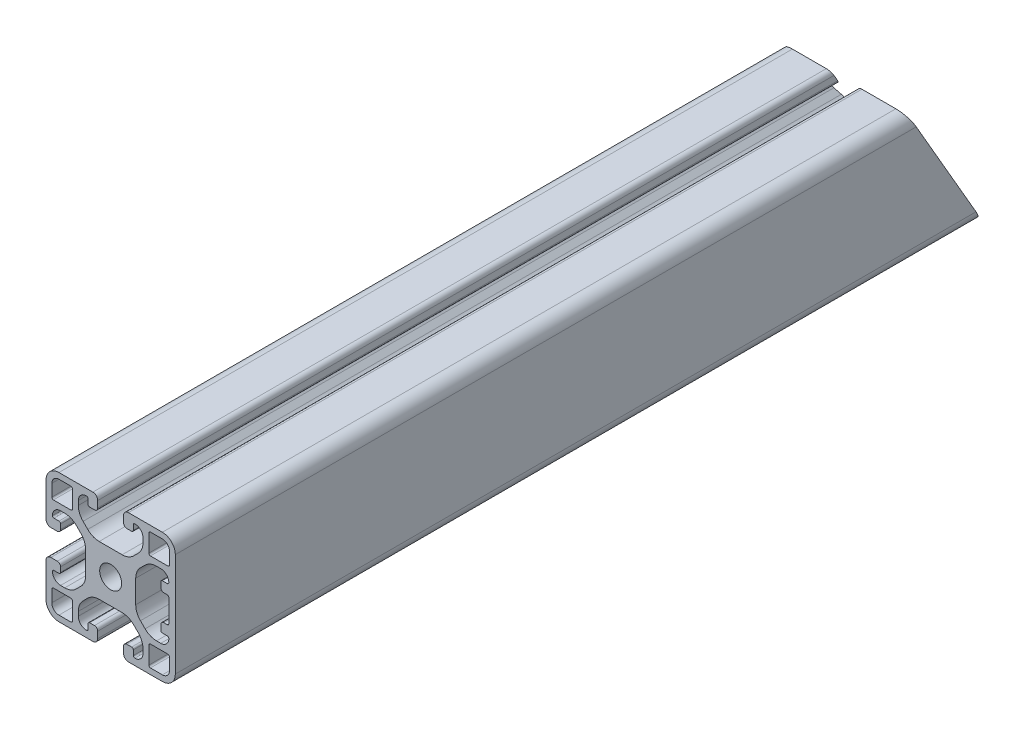
from build123d import *

# Parameters (mm, degrees)
SCHIZZO1_R                   = 3.4
ESTRUSIONE_ESTRUSIONE1_DEPTH = 250
TAGLIO_ESTRUSIONE1_DEPTH     = 343.92856399


with BuildPart() as part:
    # Schizzo1 → Estrusione-Estrusione1 (new body)
    with BuildSketch(Plane(origin=(0, 0, -340), x_dir=(-1, 0, 0), z_dir=(0, 0, -1))):
        with BuildLine():
            Line((6.5, -15.5), (5, -15.5))
            ThreePointArc((5, -15.5), (4.292893219, -15.792893219), (4, -16.5))
            Line((4, -16.5), (4, -18.5))
            ThreePointArc((4, -18.5), (4.439339828, -19.560660172), (5.5, -20))
            Line((5.5, -20), (16, -20))
            ThreePointArc((16, -20), (18.828427125, -18.828427125), (20, -16))
            Line((20, -16), (20, -5.5))
            ThreePointArc((20, -5.5), (19.560660172, -4.439339828), (18.5, -4))
            Line((18.5, -4), (16.5, -4))
            ThreePointArc((16.5, -4), (15.792893219, -4.292893219), (15.5, -5))
            Line((15.5, -5), (15.5, -6.5))
            ThreePointArc((15.5, -6.5), (15.646446609, -6.853553391), (16, -7))
            Line((16, -7), (17.55, -7))
            ThreePointArc((17.55, -7), (17.868198052, -7.131801948), (18, -7.45))
            Line((18, -7.45), (18, -7.5))
            ThreePointArc((18, -7.5), (17.267766953, -9.267766953), (15.5, -10))
            Line((15.5, -10), (14.192388155, -10))
            ThreePointArc((14.192388155, -10), (12.278970994, -9.619397663), (10.656854249, -8.535533906))
            Line((10.656854249, -8.535533906), (9.214466094, -7.09314575))
            ThreePointArc((9.214466094, -7.09314575), (8.130602337, -5.471029006), (7.75, -3.557611845))
            Line((7.75, -3.557611845), (7.75, 3.557611845))
            ThreePointArc((7.75, 3.557611845), (8.130602337, 5.471029006), (9.214466094, 7.09314575))
            Line((9.214466094, 7.09314575), (10.656854249, 8.535533906))
            ThreePointArc((10.656854249, 8.535533906), (12.278970994, 9.619397663), (14.192388155, 10))
            Line((14.192388155, 10), (15.5, 10))
            ThreePointArc((15.5, 10), (17.267766953, 9.267766953), (18, 7.5))
            Line((18, 7.5), (18, 7.45))
            ThreePointArc((18, 7.45), (17.868198052, 7.131801948), (17.55, 7))
            Line((17.55, 7), (16, 7))
            ThreePointArc((16, 7), (15.646446609, 6.853553391), (15.5, 6.5))
            Line((15.5, 6.5), (15.5, 5))
            ThreePointArc((15.5, 5), (15.792893219, 4.292893219), (16.5, 4))
            Line((16.5, 4), (18.5, 4))
            ThreePointArc((18.5, 4), (19.560660172, 4.439339828), (20, 5.5))
            Line((20, 5.5), (20, 16))
            ThreePointArc((20, 16), (18.828427125, 18.828427125), (16, 20))
            Line((16, 20), (5.5, 20))
            ThreePointArc((5.5, 20), (4.439339828, 19.560660172), (4, 18.5))
            Line((4, 18.5), (4, 16.5))
            ThreePointArc((4, 16.5), (4.292893219, 15.792893219), (5, 15.5))
            Line((5, 15.5), (6.5, 15.5))
            ThreePointArc((6.5, 15.5), (6.853553391, 15.646446609), (7, 16))
            Line((7, 16), (7, 17.55))
            ThreePointArc((7, 17.55), (7.131801948, 17.868198052), (7.45, 18))
            Line((7.45, 18), (7.5, 18))
            ThreePointArc((7.5, 18), (9.267766953, 17.267766953), (10, 15.5))
            Line((10, 15.5), (10, 14.192388155))
            ThreePointArc((10, 14.192388155), (9.619397663, 12.278970994), (8.535533906, 10.656854249))
            Line((8.535533906, 10.656854249), (7.09314575, 9.214466094))
            ThreePointArc((7.09314575, 9.214466094), (5.471029006, 8.130602337), (3.557611844, 7.75))
            Line((3.557611844, 7.75), (-3.557611845, 7.75))
            ThreePointArc((-3.557611845, 7.75), (-5.471029006, 8.130602337), (-7.09314575, 9.214466094))
            Line((-7.09314575, 9.214466094), (-8.535533906, 10.656854249))
            ThreePointArc((-8.535533906, 10.656854249), (-9.619397663, 12.278970994), (-10, 14.192388155))
            Line((-10, 14.192388155), (-10, 15.5))
            ThreePointArc((-10, 15.5), (-9.267766953, 17.267766953), (-7.5, 18))
            Line((-7.5, 18), (-7.45, 18))
            ThreePointArc((-7.45, 18), (-7.131801948, 17.868198052), (-7, 17.55))
            Line((-7, 17.55), (-7, 16))
            ThreePointArc((-7, 16), (-6.853553391, 15.646446609), (-6.5, 15.5))
            Line((-6.5, 15.5), (-5, 15.5))
            ThreePointArc((-5, 15.5), (-4.292893219, 15.792893219), (-4, 16.5))
            Line((-4, 16.5), (-4, 18.5))
            ThreePointArc((-4, 18.5), (-4.439339828, 19.560660172), (-5.5, 20))
            Line((-5.5, 20), (-16, 20))
            ThreePointArc((-16, 20), (-18.828427125, 18.828427125), (-20, 16))
            Line((-20, 16), (-20, -16))
            ThreePointArc((-20, -16), (-18.828427125, -18.828427125), (-16, -20))
            Line((-16, -20), (-5.5, -20))
            ThreePointArc((-5.5, -20), (-4.439339828, -19.560660172), (-4, -18.5))
            Line((-4, -18.5), (-4, -16.5))
            ThreePointArc((-4, -16.5), (-4.292893219, -15.792893219), (-5, -15.5))
            Line((-5, -15.5), (-6.5, -15.5))
            ThreePointArc((-6.5, -15.5), (-6.853553391, -15.646446609), (-7, -16))
            Line((-7, -16), (-7, -17.55))
            ThreePointArc((-7, -17.55), (-7.131801948, -17.868198052), (-7.45, -18))
            Line((-7.45, -18), (-7.5, -18))
            ThreePointArc((-7.5, -18), (-9.267766953, -17.267766953), (-10, -15.5))
            Line((-10, -15.5), (-10, -14.192388155))
            ThreePointArc((-10, -14.192388155), (-9.619397663, -12.278970994), (-8.535533906, -10.656854249))
            Line((-8.535533906, -10.656854249), (-7.09314575, -9.214466094))
            ThreePointArc((-7.09314575, -9.214466094), (-5.471029006, -8.130602337), (-3.557611845, -7.75))
            Line((-3.557611845, -7.75), (3.557611845, -7.75))
            ThreePointArc((3.557611845, -7.75), (5.471029006, -8.130602337), (7.09314575, -9.214466094))
            Line((7.09314575, -9.214466094), (8.535533906, -10.656854249))
            ThreePointArc((8.535533906, -10.656854249), (9.619397663, -12.278970994), (10, -14.192388155))
            Line((10, -14.192388155), (10, -15.5))
            ThreePointArc((10, -15.5), (9.267766953, -17.267766953), (7.5, -18))
            Line((7.5, -18), (7.45, -18))
            ThreePointArc((7.45, -18), (7.131801948, -17.868198052), (7, -17.55))
            Line((7, -17.55), (7, -16))
            ThreePointArc((7, -16), (6.853553391, -15.646446609), (6.5, -15.5))
        make_face()
        with Locations(Location((0, 0, 0), (0, 0, 180))):
            Circle(SCHIZZO1_R, mode=Mode.SUBTRACT)
        with BuildLine():
            Line((-12.3, -18.2), (-16, -18.2))
            ThreePointArc((-16, -18.2), (-17.555634919, -17.555634919), (-18.2, -16))
            Line((-18.2, -16), (-18.2, -12.3))
            ThreePointArc((-18.2, -12.3), (-18.053553391, -11.946446609), (-17.7, -11.8))
            Line((-17.7, -11.8), (-12.3, -11.8))
            ThreePointArc((-12.3, -11.8), (-11.946446609, -11.946446609), (-11.8, -12.3))
            Line((-11.8, -12.3), (-11.8, -17.7))
            ThreePointArc((-11.8, -17.7), (-11.946446609, -18.053553391), (-12.3, -18.2))
        make_face(mode=Mode.SUBTRACT)
        with BuildLine():
            Line((-11.8, 17.7), (-11.8, 12.3))
            ThreePointArc((-11.8, 12.3), (-11.946446609, 11.946446609), (-12.3, 11.8))
            Line((-12.3, 11.8), (-17.7, 11.8))
            ThreePointArc((-17.7, 11.8), (-18.053553391, 11.946446609), (-18.2, 12.3))
            Line((-18.2, 12.3), (-18.2, 16))
            ThreePointArc((-18.2, 16), (-17.555634919, 17.555634919), (-16, 18.2))
            Line((-16, 18.2), (-12.3, 18.2))
            ThreePointArc((-12.3, 18.2), (-11.946446609, 18.053553391), (-11.8, 17.7))
        make_face(mode=Mode.SUBTRACT)
        with BuildLine():
            Line((18.2, 16), (18.2, 12.3))
            ThreePointArc((18.2, 12.3), (18.053553391, 11.946446609), (17.7, 11.8))
            Line((17.7, 11.8), (12.3, 11.8))
            ThreePointArc((12.3, 11.8), (11.946446609, 11.946446609), (11.8, 12.3))
            Line((11.8, 12.3), (11.8, 17.7))
            ThreePointArc((11.8, 17.7), (11.946446609, 18.053553391), (12.3, 18.2))
            Line((12.3, 18.2), (16, 18.2))
            ThreePointArc((16, 18.2), (17.555634919, 17.555634919), (18.2, 16))
        make_face(mode=Mode.SUBTRACT)
        with BuildLine():
            Line((18.2, -12.3), (18.2, -16))
            ThreePointArc((18.2, -16), (17.555634919, -17.555634919), (16, -18.2))
            Line((16, -18.2), (12.3, -18.2))
            ThreePointArc((12.3, -18.2), (11.946446609, -18.053553391), (11.8, -17.7))
            Line((11.8, -17.7), (11.8, -12.3))
            ThreePointArc((11.8, -12.3), (11.946446609, -11.946446609), (12.3, -11.8))
            Line((12.3, -11.8), (17.7, -11.8))
            ThreePointArc((17.7, -11.8), (18.053553391, -11.946446609), (18.2, -12.3))
        make_face(mode=Mode.SUBTRACT)
        with BuildLine():
            Line((-16, 7), (-17.5, 7))
            ThreePointArc((-17.5, 7), (-17.853553391, 7.146446609), (-18, 7.5))
            ThreePointArc((-18, 7.5), (-17.267766953, 9.267766953), (-15.5, 10))
            Line((-15.5, 10), (-14.192388155, 10))
            ThreePointArc((-14.192388155, 10), (-12.278970994, 9.619397663), (-10.656854249, 8.535533906))
            Line((-10.656854249, 8.535533906), (-9.214466094, 7.093145751))
            ThreePointArc((-9.214466094, 7.093145751), (-8.130602337, 5.471029006), (-7.75, 3.557611845))
            Line((-7.75, 3.557611845), (-7.75, -3.557611845))
            ThreePointArc((-7.75, -3.557611845), (-8.130602337, -5.471029006), (-9.214466094, -7.093145751))
            Line((-9.214466094, -7.093145751), (-10.656854249, -8.535533906))
            ThreePointArc((-10.656854249, -8.535533906), (-12.278970994, -9.619397663), (-14.192388155, -10))
            Line((-14.192388155, -10), (-15.5, -10))
            ThreePointArc((-15.5, -10), (-17.267766953, -9.267766953), (-18, -7.5))
            ThreePointArc((-18, -7.5), (-17.853553391, -7.146446609), (-17.5, -7))
            Line((-17.5, -7), (-16, -7))
            ThreePointArc((-16, -7), (-15.646446609, -6.853553391), (-15.5, -6.5))
            Line((-15.5, -6.5), (-15.5, -5))
            ThreePointArc((-15.5, -5), (-15.792893219, -4.292893219), (-16.5, -4))
            Line((-16.5, -4), (-17.5, -4))
            ThreePointArc((-17.5, -4), (-17.853553391, -3.853553391), (-18, -3.5))
            Line((-18, -3.5), (-18, 3.5))
            ThreePointArc((-18, 3.5), (-17.853553391, 3.853553391), (-17.5, 4))
            Line((-17.5, 4), (-16.5, 4))
            ThreePointArc((-16.5, 4), (-15.792893219, 4.292893219), (-15.5, 5))
            Line((-15.5, 5), (-15.5, 6.5))
            ThreePointArc((-15.5, 6.5), (-15.646446609, 6.853553391), (-16, 7))
        make_face(mode=Mode.SUBTRACT)
    extrude(amount=-ESTRUSIONE_ESTRUSIONE1_DEPTH)

    # Schizzo9 → Taglio-Estrusione1 (cut, through all)
    with BuildSketch(Plane(origin=(20, 0, 0), x_dir=(0, 0, -1), z_dir=(1, 0, 0))):
        Polygon((340, -20), (340, -16), (340, 16), (340, 20), (316.88952566, 20), align=None)
    extrude(amount=-TAGLIO_ESTRUSIONE1_DEPTH, mode=Mode.SUBTRACT)


solid = part.part
